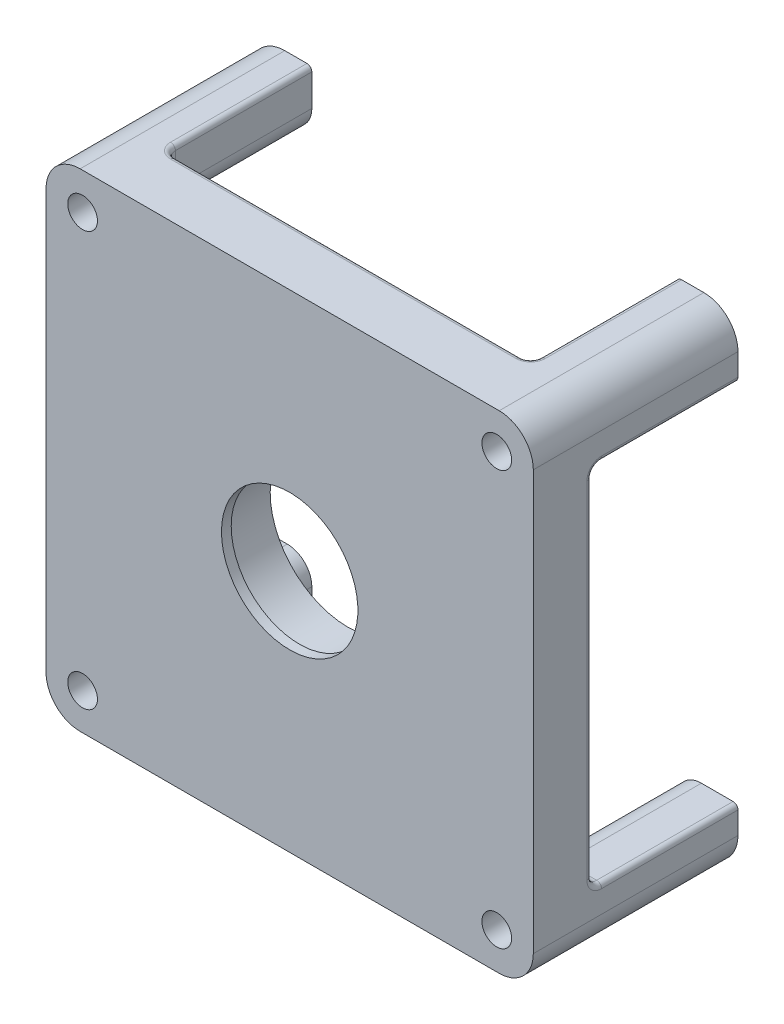
from build123d import *

# Parameters (mm, degrees)
SKETCH2_W            = 100
SKETCH2_H            = 100
BOSS_EXTRUDE1_DEPTH  = 12
SKETCH3_R            = 16
CUT_EXTRUDE1_DEPTH   = 10
M6_CLEARANCE_HOLE1_D = 6.1
BOSS_EXTRUDE2_START  = 30
SKETCH17_R           = 3.05
BOSS_EXTRUDE2_DEPTH  = 30
CIRPATTERN1_COUNT    = 4
SKETCH18_R           = 14
CUT_EXTRUDE3_DEPTH   = 77.811457479
FILLET1_R            = 2
FILLET2_R            = 7
FILLET3_R            = 1


with BuildPart() as part:
    # Sketch2 → Boss-Extrude1 (new body)
    with BuildSketch(Plane.XY):
        Rectangle(SKETCH2_W, SKETCH2_H)
    extrude(amount=BOSS_EXTRUDE1_DEPTH)

    # Sketch3 → Cut-Extrude1 (cut)
    with BuildSketch(Plane(origin=(0, 0, 0), x_dir=(-1, 0, 0), z_dir=(0, 0, -1))):
        Circle(SKETCH3_R)
    extrude(amount=-CUT_EXTRUDE1_DEPTH, mode=Mode.SUBTRACT)

    # M6 Clearance Hole1 (through all)
    with Locations(Plane(origin=(0, 0, 12), x_dir=(-1, 0, 0), z_dir=(0, 0, 1))):
        with Locations((42.5, -42.5), (-42.5, 42.5), (-42.5, -42.5), (42.5, 42.5)):
            Hole(M6_CLEARANCE_HOLE1_D / 2)

    # Sketch17 → Boss-Extrude2 (add)
    with BuildSketch(Plane(origin=(0, 0, 0), x_dir=(-1, 0, 0), z_dir=(0, 0, -1)).offset(BOSS_EXTRUDE2_START)):
        with BuildLine():
            Line((-37.45, 42.5), (-37.45, 50))
            Line((-37.45, 50), (-50, 50))
            Line((-50, 50), (-50, 37.45))
            Line((-50, 37.45), (-42.5, 37.45))
            ThreePointArc((-42.5, 37.45), (-38.929110755, 38.929110755), (-37.45, 42.5))
        make_face()
        with Locations(Location((-42.5, 42.5, 0), (0, 0, 180))):
            Circle(SKETCH17_R, mode=Mode.SUBTRACT)
    boss_extrude2 = extrude(amount=-BOSS_EXTRUDE2_DEPTH)

    # CirPattern1: Boss-Extrude2 ×4 about axis
    cirpattern1_axis = Axis((0, 0, 0), (0, 0, 1))
    for i in range(1, CIRPATTERN1_COUNT):
        add(boss_extrude2.rotate(cirpattern1_axis, i * 360 / CIRPATTERN1_COUNT))

    # Sketch18 → Cut-Extrude3 (cut, through all)
    with BuildSketch(Plane(origin=(0, 0, 0), x_dir=(-1, 0, 0), z_dir=(0, 0, -1))):
        Circle(SKETCH18_R)
    extrude(amount=-CUT_EXTRUDE3_DEPTH, mode=Mode.SUBTRACT)

    # Fillet1
    fillet1_edges = [part.edges().sort_by_distance(p)[0] for p in [
        (38.929110755, 38.929110755, 0),
        (37.45, 46.25, 0),
        (46.25, 37.45, 0),
        (-38.929110755, 38.929110755, 0),
        (-46.25, 37.45, 0),
        (-37.45, 46.25, 0),
        (-38.929110755, -38.929110755, 0),
        (-37.45, -46.25, 0),
        (-46.25, -37.45, 0),
        (38.929110755, -38.929110755, 0),
        (46.25, -37.45, 0),
        (37.45, -46.25, 0),
    ]]
    fillet(fillet1_edges, radius=FILLET1_R)

    # Fillet2
    fillet2_edges = [part.edges().sort_by_distance(p)[0] for p in [
        (50, -50, -9),
        (-50, -50, -9),
        (-50, 50, -9),
        (50, 50, -9),
    ]]
    fillet(fillet2_edges, radius=FILLET2_R)

    # Fillet3
    fillet3_edges = [part.edges().sort_by_distance(p)[0] for p in [
        (50, 0, 0),
        (0, -50, 0),
        (-50, 0, 0),
        (0, 50, 0),
        (-36.864213562, 50, -0.585786438),
        (-50, 36.864213562, -0.585786438),
        (-50, -36.864213562, -0.585786438),
        (-36.864213562, -50, -0.585786438),
        (36.864213562, -50, -0.585786438),
        (50, -36.864213562, -0.585786438),
        (50, 36.864213562, -0.585786438),
        (36.864213562, 50, -0.585786438),
        (37.45, 50, -16),
        (50, 37.45, -16),
        (-50, 37.45, -16),
        (-37.45, 50, -16),
        (-37.45, -50, -16),
        (-50, -37.45, -16),
        (50, -37.45, -16),
        (37.45, -50, -16),
    ]]
    fillet(fillet3_edges, radius=FILLET3_R)


solid = part.part
